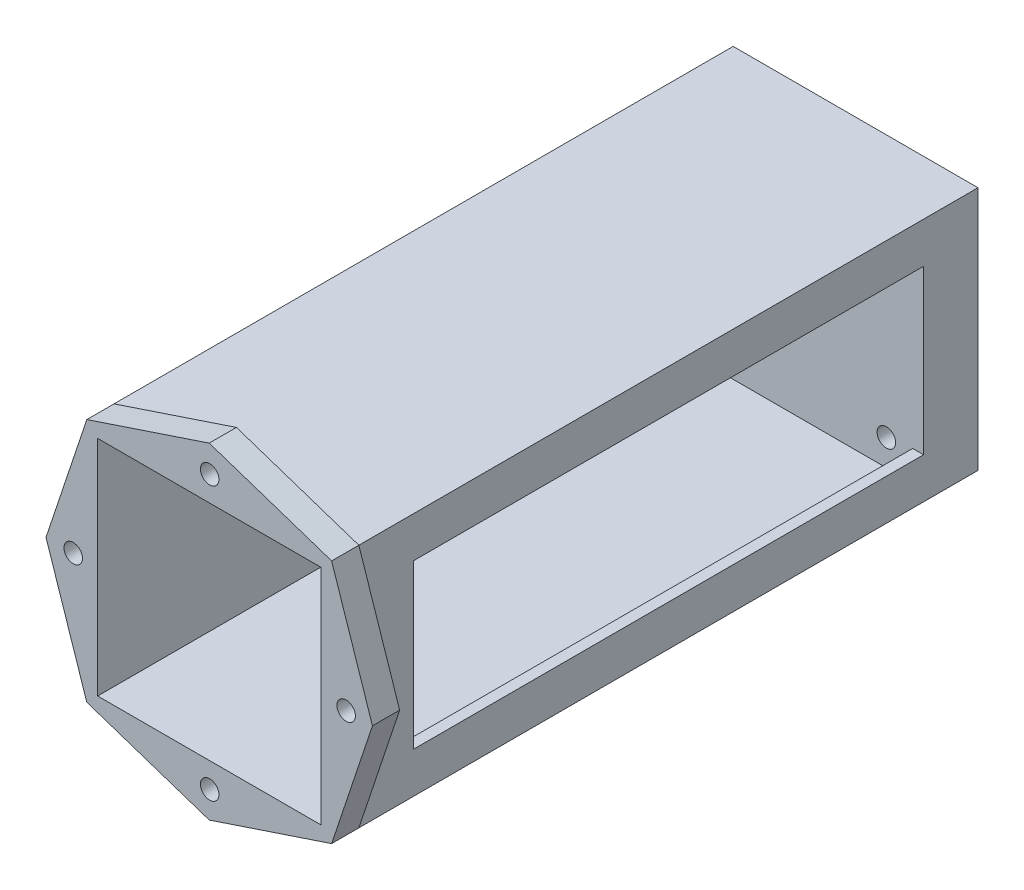
from build123d import *

# Parameters (mm, degrees)
ESTRUSIONE_ESTRUSIONE1_DEPTH = 5
FORO_PER_VITE_M3_1_D         = 3.4
RIPETIZIONECIRCOLARE1_COUNT  = 4
SCHIZZO4_W                   = 45
SCHIZZO4_H                   = 45
ESTRUSIONE_ESTRUSIONE2_DEPTH = 103.8
SCHIZZO5_W                   = 41
SCHIZZO5_H                   = 41
TAGLIO_ESTRUSIONE1_DEPTH     = 117.779450247
TAGLIO_ESTRUSIONE2_REACH     = 126.474
SCHIZZO6_W                   = 30
SCHIZZO6_H                   = 93.8
SCHIZZO7_W                   = 45
SCHIZZO7_H                   = 45
ESTRUSIONE_ESTRUSIONE3_DEPTH = 10
JOINT_MOTOR_HOUSING_D        = 3.4
RIPETIZIONECIRCOLARE2_COUNT  = 4
JOINT_MOTOR_ARM_D            = 5.5


with BuildPart() as part:
    # Schizzo1 → Estrusione-Estrusione1 (new body)
    with BuildSketch(Plane(origin=(0, 0, 0), x_dir=(0, 1, 0), z_dir=(0, 0, 1))):
        Polygon((-22.5, 22.5), (-30, 0), (-22.5, -22.5), (0, -30), (22.5, -22.5), (30, 0), (22.5, 22.5), (0, 30), align=None)
    extrude(amount=-ESTRUSIONE_ESTRUSIONE1_DEPTH)

    # Foro per Vite M3-1 (through all)
    with Locations(Plane.XY):
        with Locations((-25, 0)):
            foro_per_vite_m3_1 = Hole(FORO_PER_VITE_M3_1_D / 2)

    # RipetizioneCircolare1: Foro per Vite M3-1 ×4 about axis
    ripetizionecircolare1_axis = Axis((0.084350334, 0, 0), (0, 0, 1))
    for i in range(1, RIPETIZIONECIRCOLARE1_COUNT):
        add(foro_per_vite_m3_1.rotate(ripetizionecircolare1_axis, i * 360 / RIPETIZIONECIRCOLARE1_COUNT), mode=Mode.SUBTRACT)

    # Schizzo4 → Estrusione-Estrusione2 (add)
    with BuildSketch(Plane(origin=(0, 0, -5), x_dir=(1, 0, 0), z_dir=(0, 0, -1))):
        Rectangle(SCHIZZO4_W, SCHIZZO4_H)
    extrude(amount=ESTRUSIONE_ESTRUSIONE2_DEPTH)

    # Schizzo5 → Taglio-Estrusione1 (cut, through all)
    with BuildSketch(Plane(origin=(0, 0, -108.8), x_dir=(1, 0, 0), z_dir=(0, 0, -1))):
        Rectangle(SCHIZZO5_W, SCHIZZO5_H)
    extrude(amount=-TAGLIO_ESTRUSIONE1_DEPTH, mode=Mode.SUBTRACT)

    # Schizzo6 → Taglio-Estrusione2 (cut, up to next)
    with BuildSketch(Plane.YZ.offset(22.5), mode=Mode.PRIVATE) as taglio_estrusione2_sk1:
        with Locations((0, -61.9)):
            Rectangle(SCHIZZO6_W, SCHIZZO6_H)
    taglio_estrusione2_tool1 = extrude(taglio_estrusione2_sk1.sketch, amount=-TAGLIO_ESTRUSIONE2_REACH, mode=Mode.PRIVATE) & part.part
    add(taglio_estrusione2_tool1.solids().sort_by_distance((22.5, 0, -61.9))[0], mode=Mode.SUBTRACT)

    # Schizzo7 → Estrusione-Estrusione3 (add)
    with BuildSketch(Plane(origin=(0, 0, -108.8), x_dir=(1, 0, 0), z_dir=(0, 0, -1))):
        Rectangle(SCHIZZO7_W, SCHIZZO7_H)
    extrude(amount=ESTRUSIONE_ESTRUSIONE3_DEPTH)

    # Joint-motor-housing (through all)
    with Locations(Plane(origin=(0, 0, -118.8), x_dir=(-1, 0, 0), z_dir=(0, 0, -1))):
        with Locations((15.52, 15.52)):
            joint_motor_housing = Hole(JOINT_MOTOR_HOUSING_D / 2)

    # RipetizioneCircolare2: Joint-motor-housing ×4 about axis
    ripetizionecircolare2_axis = Axis((0.069898196, -0.069898196, 0), (0, 0, 1))
    for i in range(1, RIPETIZIONECIRCOLARE2_COUNT):
        add(joint_motor_housing.rotate(ripetizionecircolare2_axis, i * 360 / RIPETIZIONECIRCOLARE2_COUNT), mode=Mode.SUBTRACT)

    # Joint-motor-arm (through all)
    with Locations(Plane(origin=(0, 0, -118.8), x_dir=(-1, 0, 0), z_dir=(0, 0, -1))):
        with Locations((0, 0)):
            Hole(JOINT_MOTOR_ARM_D / 2)


solid = part.part
